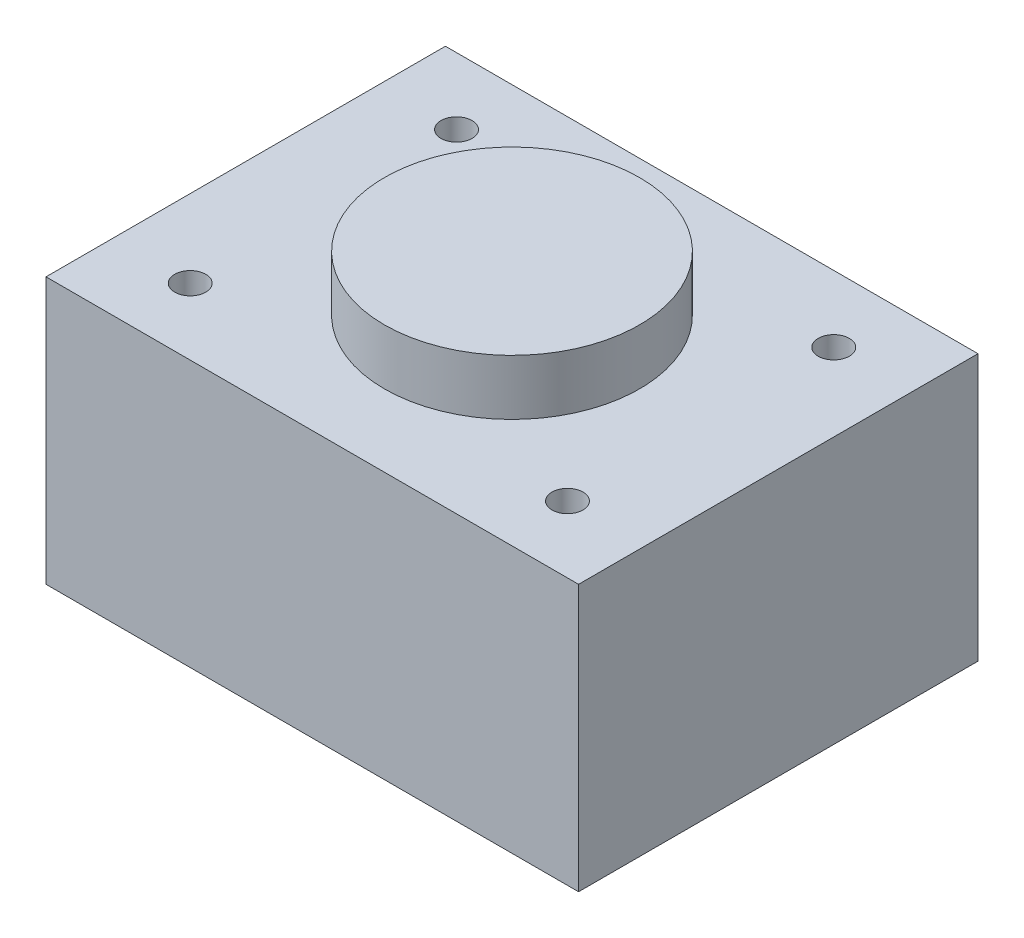
from build123d import *

# Parameters (mm, degrees)
F_01_HOUSING_PROFILE_W        = 240
F_01_HOUSING_PROFILE_H        = 180
F_01_HOUSING_PROFILE_R        = 7
F_01_HOUSING_BLOCK_DEPTH      = 120
F_02_FACE_BOSS_PROFILE_R      = 57.5
F_02_FACE_LOCATING_BOSS_DEPTH = 145


with BuildPart() as part:
    # 01_Housing_Profile → 01_Housing_Block (new body)
    with BuildSketch(Plane(origin=(0, 0, 0), x_dir=(1, 0, 0), z_dir=(0, 1, 0))):
        Rectangle(F_01_HOUSING_PROFILE_W, F_01_HOUSING_PROFILE_H)
        with Locations(Location((-85, -60, 0), (0, 0, 270))):
            Circle(F_01_HOUSING_PROFILE_R, mode=Mode.SUBTRACT)
        with Locations(Location((85, -60, 0), (0, 0, 270))):
            Circle(F_01_HOUSING_PROFILE_R, mode=Mode.SUBTRACT)
        with Locations(Location((-85, 60, 0), (0, 0, 270))):
            Circle(F_01_HOUSING_PROFILE_R, mode=Mode.SUBTRACT)
        with Locations(Location((85, 60, 0), (0, 0, 270))):
            Circle(F_01_HOUSING_PROFILE_R, mode=Mode.SUBTRACT)
    extrude(amount=F_01_HOUSING_BLOCK_DEPTH)

    # 02_Face_Boss_Profile → 02_Face_Locating_Boss (add)
    with BuildSketch(Plane(origin=(0, 0, 0), x_dir=(1, 0, 0), z_dir=(0, 1, 0))):
        with Locations(Location((0, 0, 0), (0, 0, 90))):
            Circle(F_02_FACE_BOSS_PROFILE_R)
    extrude(amount=F_02_FACE_LOCATING_BOSS_DEPTH)


solid = part.part
